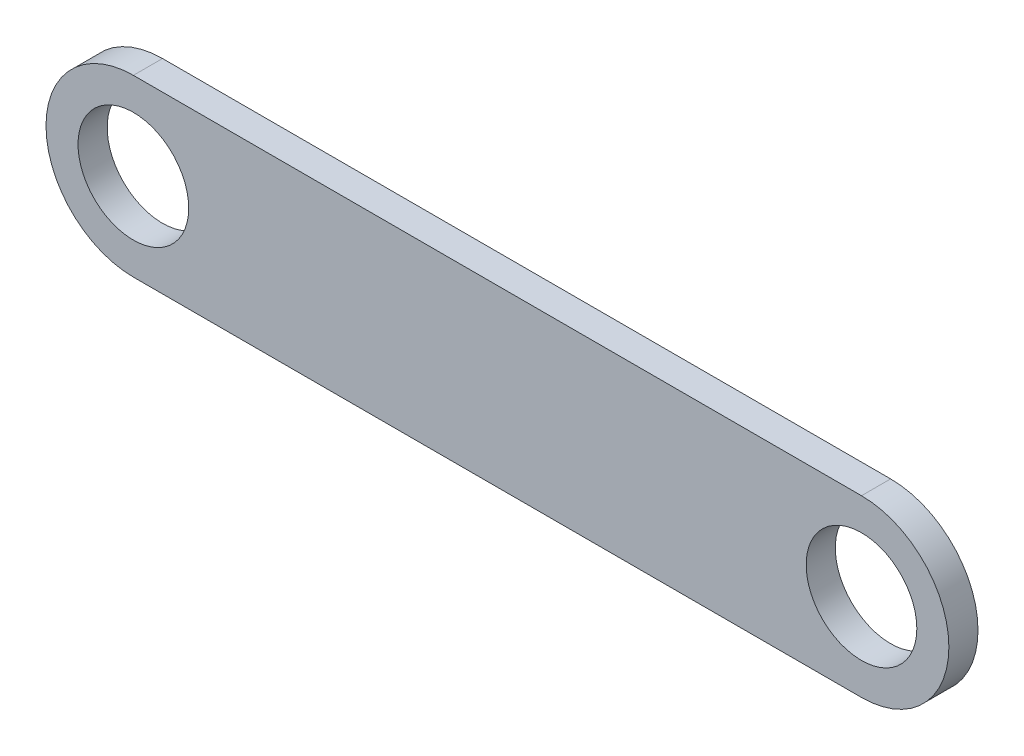
from build123d import *

# Parameters (mm, degrees)
SKETCH1_R           = 9.5
BOSS_EXTRUDE1_DEPTH = 5


with BuildPart() as part:
    # Sketch1 → Boss-Extrude1 (new body)
    with BuildSketch(Plane.XY):
        with BuildLine():
            Line((0, 15), (125, 15))
            ThreePointArc((125, 15), (140, 0), (125, -15))
            Line((125, -15), (0, -15))
            ThreePointArc((0, -15), (-15, 0), (0, 15))
        make_face()
        Circle(SKETCH1_R, mode=Mode.SUBTRACT)
        with Locations((125, 0)):
            Circle(SKETCH1_R, mode=Mode.SUBTRACT)
    extrude(amount=BOSS_EXTRUDE1_DEPTH)


solid = part.part
